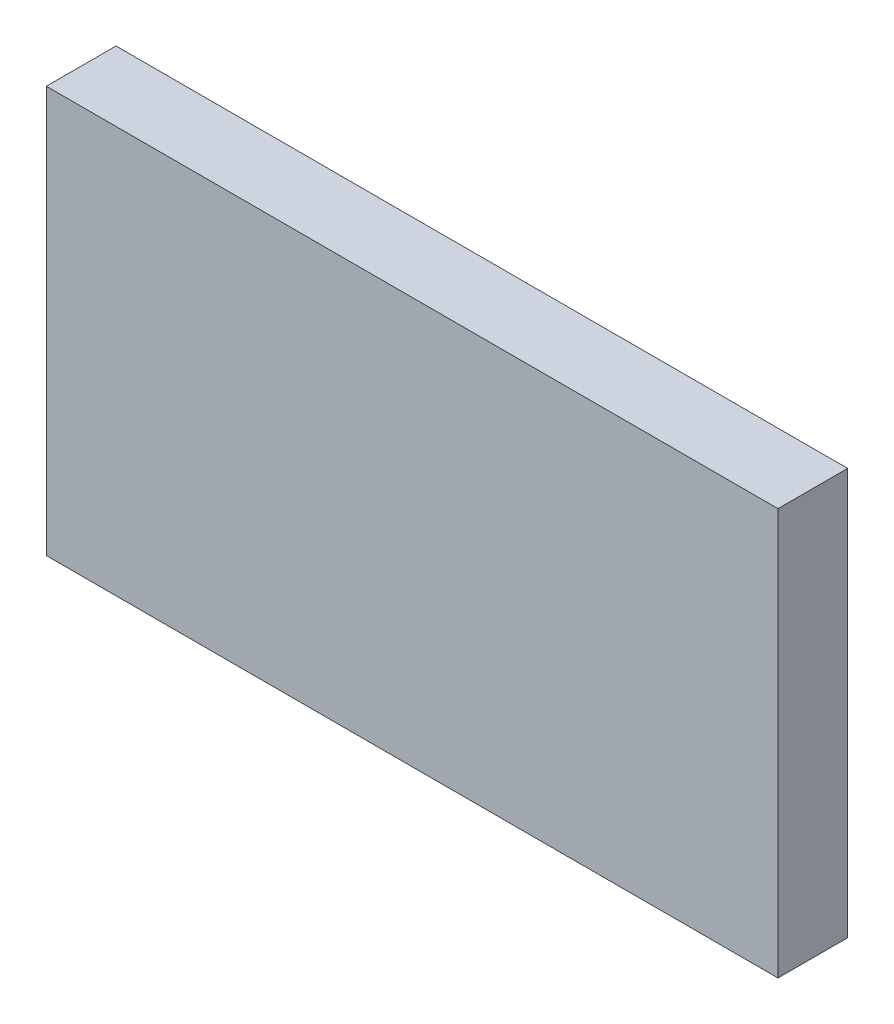
from build123d import *

# Parameters (mm, degrees)
SKETCH1_W           = 126
SKETCH1_H           = 70
BOSS_EXTRUDE1_DEPTH = 12


with BuildPart() as part:
    # Sketch1 → Boss-Extrude1 (new body)
    with BuildSketch(Plane.XY):
        with Locations((63, 35)):
            Rectangle(SKETCH1_W, SKETCH1_H)
    extrude(amount=BOSS_EXTRUDE1_DEPTH)


solid = part.part
